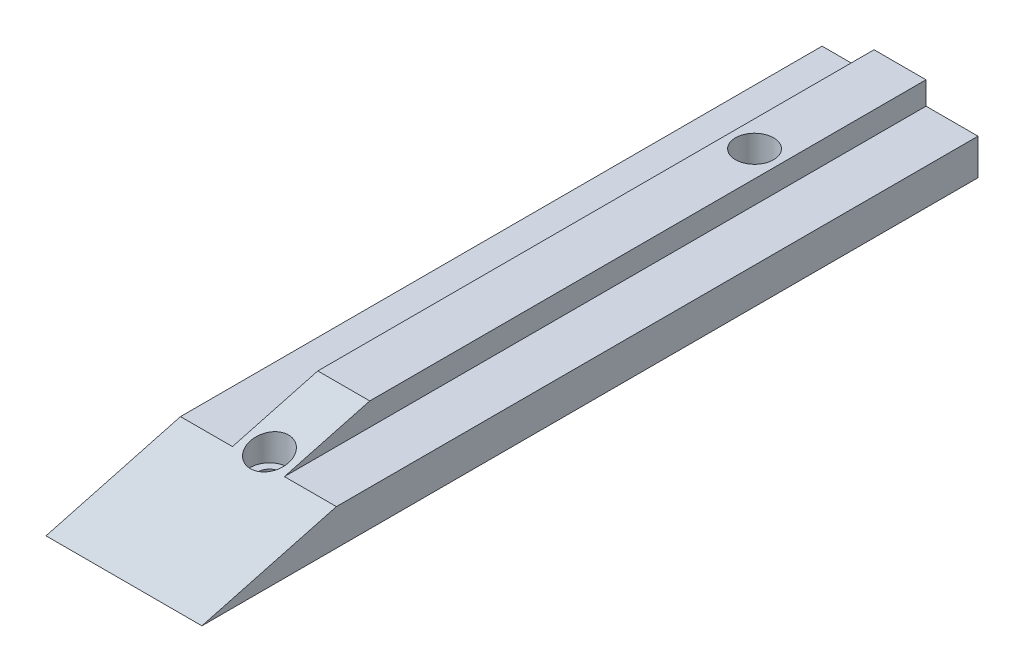
from build123d import *

# Parameters (mm, degrees)
EXTRUDE_1_DEPTH             = 112
CUT_EXTRUDE_2_DEPTH         = 122.893396048
HOLE_WIZARD_M61_D           = 6.6
HOLE_WIZARD_M61_DEPTH       = 20
HOLE_WIZARD_M61_CBORE_D     = 11
HOLE_WIZARD_M61_CBORE_DEPTH = 12.4
HOLE_WIZARD_M61_TIP         = 1.982840043


with BuildPart() as part:
    # Эскиз1 → Бобышка-Вытянуть1 (new, symmetric)
    with BuildSketch(Plane.XY):
        Polygon((22.5, 0), (-22.5, 0), (-22.5, 10.4), (-7.5, 10.4), (-7.5, 17), (7.5, 17), (7.5, 10.4), (22.5, 10.4), align=None)
    extrude(amount=EXTRUDE_1_DEPTH, both=True)

    # Эскиз5 → Вырез-Вытянуть2 (cut, through all)
    with BuildSketch(Plane(origin=(22.5, 0, 0), x_dir=(0, 0, -1), z_dir=(1, 0, 0))):
        Polygon((-112, 0), (-48.555136271, 17), (-112, 17), align=None)
    extrude(amount=-CUT_EXTRUDE_2_DEPTH, mode=Mode.SUBTRACT)

    # Цековка для винта с внутренним шестигранником M61
    with Locations(Plane(origin=(0, 17, 0), x_dir=(1, 0, 0), z_dir=(0, 1, 0))):
        with Locations((0, -210), (0, 70), (0, -70)):
            CounterBoreHole(HOLE_WIZARD_M61_D / 2, HOLE_WIZARD_M61_CBORE_D / 2, HOLE_WIZARD_M61_CBORE_DEPTH, depth=HOLE_WIZARD_M61_DEPTH)
            with Locations((0, 0, -(HOLE_WIZARD_M61_DEPTH + HOLE_WIZARD_M61_TIP / 2))):  # 118° drill point
                Cone(0, HOLE_WIZARD_M61_D / 2, HOLE_WIZARD_M61_TIP, mode=Mode.SUBTRACT)


solid = part.part
